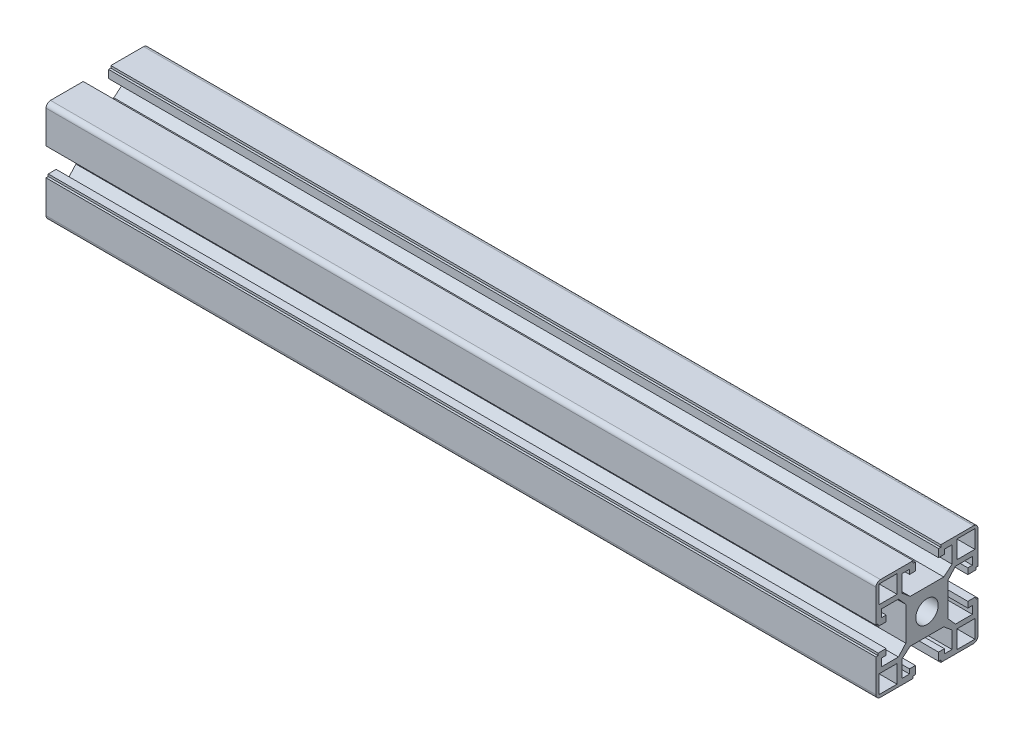
from build123d import *

# Parameters (mm, degrees)
SKETCH_1_W               = 45.5
SKETCH_1_H               = 45.5
EXTRUDE_1_DEPTH          = 370
CUT_EXTRUDE_1_REACH      = 380.964
SKETCH_2_W               = 8
SKETCH_2_H               = 8
MIRROR_2_COPY_1_REACH    = 380.964
MIRROR_2_COPY_1_SKETCH_W = 8
MIRROR_2_COPY_1_SKETCH_H = 8
CUT_EXTRUDE_2_REACH      = 380.964
MIRROR_4_COPY_1_REACH    = 380.964
FILLET_1_R               = 2
CUT_EXTRUDE_4_REACH      = 380.964
SKETCH_6_R               = 5


with BuildPart() as part:
    # 草图1 → 凸台-拉伸1 (new body)
    with BuildSketch(Plane(origin=(0, 0, 0), x_dir=(0, 0, -1), z_dir=(1, 0, 0))):
        with Locations((37.954960836, 32.285758607)):
            Rectangle(SKETCH_1_W, SKETCH_1_H)
    extrude(amount=EXTRUDE_1_DEPTH)

    # 草图2 → 切除-拉伸1 (cut, up to next)
    with BuildSketch(Plane(origin=(370, 0, 0), x_dir=(0, 0, -1), z_dir=(1, 0, 0)), mode=Mode.PRIVATE) as cut_extrude_1_sk1:
        Polygon((31.804960836, 55.035758607), (31.804960836, 54.035758607), (32.804960836, 54.035758607), (32.804960836, 50.505758607), (30.174960836, 50.505758607), (30.174960836, 52.505758607), (26.774960836, 52.505758607), (26.774960836, 45.005758607), (30.454960836, 41.905758607), (37.954960836, 41.905758607), (37.954960836, 55.035758607), align=None)
    cut_extrude_1_tool1 = extrude(cut_extrude_1_sk1.sketch, amount=-CUT_EXTRUDE_1_REACH, mode=Mode.PRIVATE) & part.part
    # 草图2 → 切除-拉伸1 (cut, up to next)
    with BuildSketch(Plane(origin=(370, 0, 0), x_dir=(0, 0, -1), z_dir=(1, 0, 0)), mode=Mode.PRIVATE) as cut_extrude_1_sk2:
        with Locations((20.604960836, 49.635758607)):
            Rectangle(SKETCH_2_W, SKETCH_2_H)
    cut_extrude_1_tool2 = extrude(cut_extrude_1_sk2.sketch, amount=-CUT_EXTRUDE_1_REACH, mode=Mode.PRIVATE) & part.part
    cut_extrude_1_1 = cut_extrude_1_tool1.solids().sort_by_distance((370, 47.983788, -32.930174))[0]
    add(cut_extrude_1_1, mode=Mode.SUBTRACT)
    cut_extrude_1_2 = cut_extrude_1_tool2.solids().sort_by_distance((370, 49.635759, -20.604961))[0]
    add(cut_extrude_1_2, mode=Mode.SUBTRACT)
    cut_extrude_1 = cut_extrude_1_1 + cut_extrude_1_2  # 切除-拉伸1 as one shape, for the pattern or mirror that repeats it

    # 镜向1: 切除-拉伸1 across plane
    add(cut_extrude_1.mirror(Plane(origin=(0, 0, -37.954960836), x_dir=(1, 0, 0), z_dir=(0, 0, -1))), mode=Mode.SUBTRACT)

    # 镜向2: 切除-拉伸1 across plane
    add(cut_extrude_1.mirror(Plane(origin=(0, 32.285758607, 0), x_dir=(0, 0, 1), z_dir=(0, -1, 0))), mode=Mode.SUBTRACT)

    # 镜向2 copy 1 sketch → 镜向2 copy 1 (cut, up to next)
    with BuildSketch(Plane(origin=(370, 64.571517214, -75.909921671), x_dir=(0, 0, 1), z_dir=(1, 0, 0)), mode=Mode.PRIVATE) as mirror_2_copy_1_sk1:
        Polygon((31.804960836, 55.035758607), (31.804960836, 54.035758607), (32.804960836, 54.035758607), (32.804960836, 50.505758607), (30.174960836, 50.505758607), (30.174960836, 52.505758607), (26.774960836, 52.505758607), (26.774960836, 45.005758607), (30.454960836, 41.905758607), (37.954960836, 41.905758607), (37.954960836, 55.035758607), align=None)
    mirror_2_copy_1_tool1 = extrude(mirror_2_copy_1_sk1.sketch, amount=-MIRROR_2_COPY_1_REACH, mode=Mode.PRIVATE) & part.part
    # 镜向2 copy 1 sketch → 镜向2 copy 1 (cut, up to next)
    with BuildSketch(Plane(origin=(370, 64.571517214, -75.909921671), x_dir=(0, 0, 1), z_dir=(1, 0, 0)), mode=Mode.PRIVATE) as mirror_2_copy_1_sk2:
        with Locations((20.604960836, 49.635758607)):
            Rectangle(MIRROR_2_COPY_1_SKETCH_W, MIRROR_2_COPY_1_SKETCH_H)
    mirror_2_copy_1_tool2 = extrude(mirror_2_copy_1_sk2.sketch, amount=-MIRROR_2_COPY_1_REACH, mode=Mode.PRIVATE) & part.part
    add(mirror_2_copy_1_tool1.solids().sort_by_distance((370, 16.587729214, -42.979747671))[0], mode=Mode.SUBTRACT)
    add(mirror_2_copy_1_tool2.solids().sort_by_distance((370, 14.935758214, -55.304960671))[0], mode=Mode.SUBTRACT)

    # 草图3 → 切除-拉伸2 (cut, up to next)
    with BuildSketch(Plane(origin=(370, 0, 0), x_dir=(0, 0, -1), z_dir=(1, 0, 0)), mode=Mode.PRIVATE) as cut_extrude_2_sk1:
        Polygon((15.204960836, 38.435758607), (16.204960836, 38.435758607), (16.204960836, 37.435758607), (19.734960836, 37.435758607), (19.734960836, 40.065758607), (17.734960836, 40.065758607), (17.734960836, 43.465758607), (25.234960836, 43.465758607), (28.534960836, 39.785758607), (28.534960836, 32.285758607), (15.204960836, 32.285758607), align=None)
    cut_extrude_2_tool1 = extrude(cut_extrude_2_sk1.sketch, amount=-CUT_EXTRUDE_2_REACH, mode=Mode.PRIVATE) & part.part
    cut_extrude_2 = cut_extrude_2_tool1.solids().sort_by_distance((370, 37.306091, -22.347242))[0]
    add(cut_extrude_2, mode=Mode.SUBTRACT)

    # 镜向3: 切除-拉伸2 across plane
    add(cut_extrude_2.mirror(Plane(origin=(0, 32.285758607, 0), x_dir=(0, 0, 1), z_dir=(0, -1, 0))), mode=Mode.SUBTRACT)

    # 镜向4: 切除-拉伸2 across plane
    add(cut_extrude_2.mirror(Plane(origin=(0, 0, -37.954960836), x_dir=(1, 0, 0), z_dir=(0, 0, -1))), mode=Mode.SUBTRACT)

    # 镜向4 copy 1 sketch → 镜向4 copy 1 (cut, up to next)
    with BuildSketch(Plane(origin=(370, 64.571517214, -75.909921671), x_dir=(0, 0, 1), z_dir=(1, 0, 0)), mode=Mode.PRIVATE) as mirror_4_copy_1_sk1:
        Polygon((15.204960836, 38.435758607), (16.204960836, 38.435758607), (16.204960836, 37.435758607), (19.734960836, 37.435758607), (19.734960836, 40.065758607), (17.734960836, 40.065758607), (17.734960836, 43.465758607), (25.234960836, 43.465758607), (28.534960836, 39.785758607), (28.534960836, 32.285758607), (15.204960836, 32.285758607), align=None)
    mirror_4_copy_1_tool1 = extrude(mirror_4_copy_1_sk1.sketch, amount=-MIRROR_4_COPY_1_REACH, mode=Mode.PRIVATE) & part.part
    add(mirror_4_copy_1_tool1.solids().sort_by_distance((370, 27.265426214, -53.562679671))[0], mode=Mode.SUBTRACT)

    # 圆角1
    fillet_1_edges = [part.edges().sort_by_distance(p)[0] for p in [
        (185, 55.035758607, -15.204960836),
        (185, 55.035758607, -60.704960836),
        (185, 9.535758607, -60.704960836),
        (185, 9.535758607, -15.204960836),
    ]]
    fillet(fillet_1_edges, radius=FILLET_1_R)

    # 草图6 → 切除-拉伸4 (cut, up to next)
    with BuildSketch(Plane(origin=(370, 0, 0), x_dir=(0, 0, -1), z_dir=(1, 0, 0)), mode=Mode.PRIVATE) as cut_extrude_4_sk1:
        with Locations((37.954960836, 32.285758607)):
            Circle(SKETCH_6_R)
    cut_extrude_4_tool1 = extrude(cut_extrude_4_sk1.sketch, amount=-CUT_EXTRUDE_4_REACH, mode=Mode.PRIVATE) & part.part
    add(cut_extrude_4_tool1.solids().sort_by_distance((370, 32.285759, -37.954961))[0], mode=Mode.SUBTRACT)


solid = part.part
